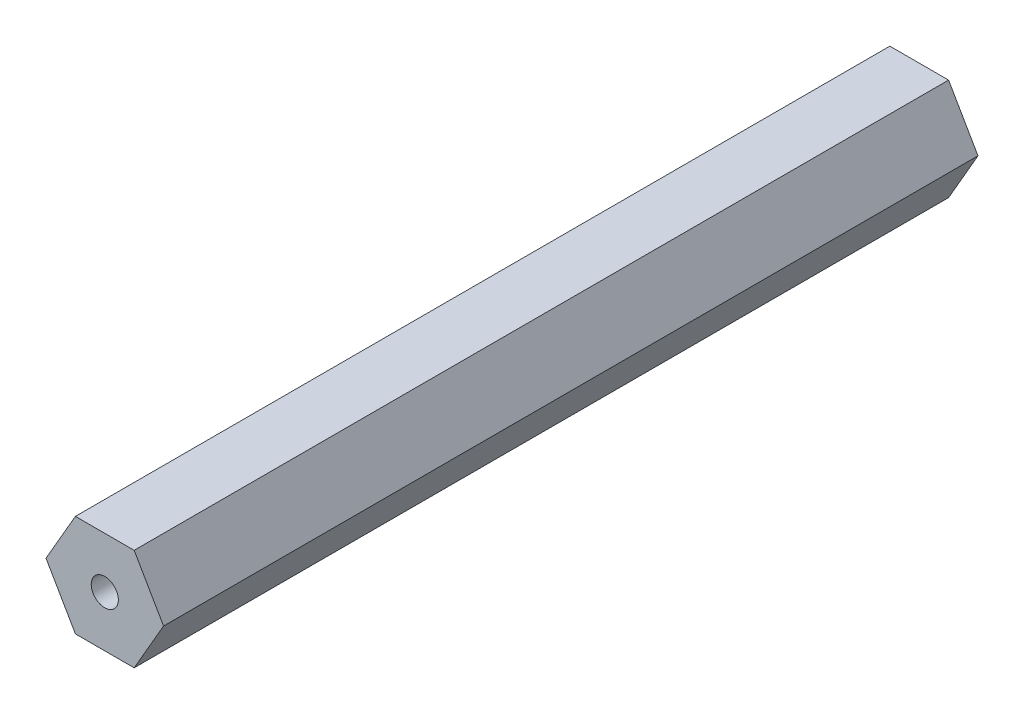
from build123d import *

# Parameters (mm, degrees)
SKETCH1_R           = 1.27
BOSS_EXTRUDE1_DEPTH = 76.2


with BuildPart() as part:
    # Sketch1 → Boss-Extrude1 (new body)
    with BuildSketch(Plane.XY):
        Polygon((16.408039326, -2.667590064), (13.658408669, 2.094909936), (8.159147355, 2.094909936), (5.409516698, -2.667590064), (8.159147355, -7.430090064), (13.658408669, -7.430090064), align=None)
        with Locations(Location((10.908778012, -2.667590064, 0), (0, 0, 180))):
            Circle(SKETCH1_R, mode=Mode.SUBTRACT)
    extrude(amount=BOSS_EXTRUDE1_DEPTH)


solid = part.part
